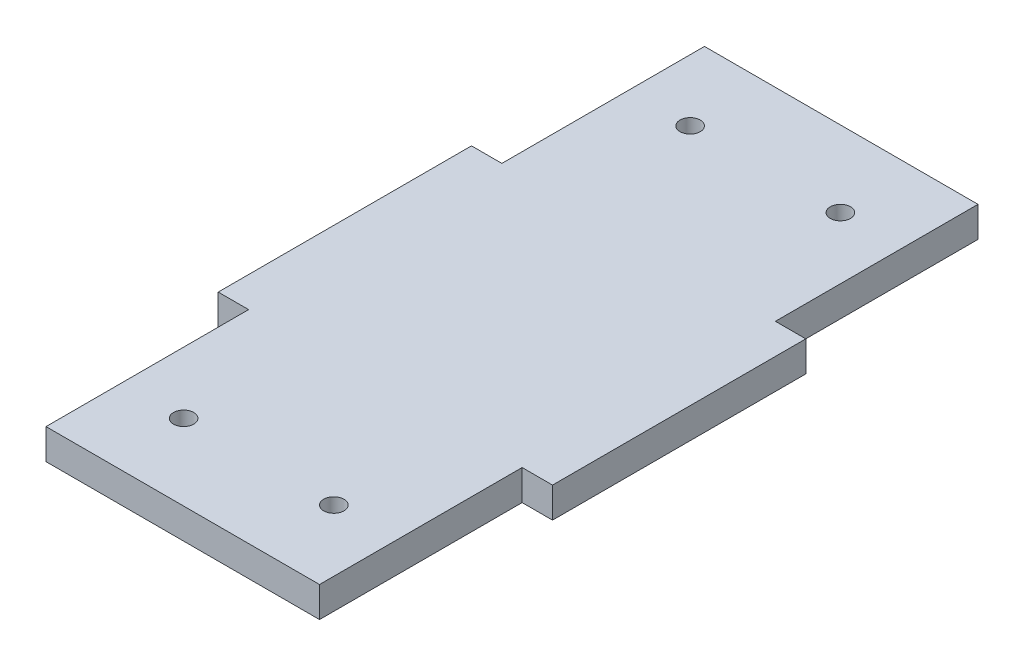
from build123d import *

# Parameters (mm, degrees)
BOSS_EXTRUDE1_DEPTH = 6
SKETCH2_R           = 2
CUT_EXTRUDE1_DEPTH  = 91.558967542


with BuildPart() as part:
    # Sketch1 → Boss-Extrude1 (new body)
    with BuildSketch(Plane(origin=(0, 0, 0), x_dir=(1, 0, 0), z_dir=(0, 1, 0))):
        Polygon((4.371579812, 18.793220339), (4.371579812, 58.793220339), (-49.628420188, 58.793220339), (-49.628420188, 18.793220339), (-55.628420188, 18.793220339), (-55.628420188, -31.206779661), (-49.628420188, -31.206779661), (-49.628420188, -71.206779661), (4.371579812, -71.206779661), (4.371579812, -31.206779661), (10.371579812, -31.206779661), (10.371579812, 18.793220339), align=None)
    extrude(amount=BOSS_EXTRUDE1_DEPTH)

    # Sketch2 → Cut-Extrude1 (cut, through all)
    with BuildSketch(Plane(origin=(0, 6, 0), x_dir=(1, 0, 0), z_dir=(0, 1, 0))):
        with Locations(Location((-7.798420188, -56.206779661, 0), (0, 0, 270))):
            Circle(SKETCH2_R)
        with Locations(Location((-7.798420188, 43.793220339, 0), (0, 0, 270))):
            Circle(SKETCH2_R)
        with Locations(Location((-37.458420188, 43.793220339, 0), (0, 0, 270))):
            Circle(SKETCH2_R)
        with Locations(Location((-37.458420188, -56.206779661, 0), (0, 0, 270))):
            Circle(SKETCH2_R)
    extrude(amount=-CUT_EXTRUDE1_DEPTH, mode=Mode.SUBTRACT)


solid = part.part
